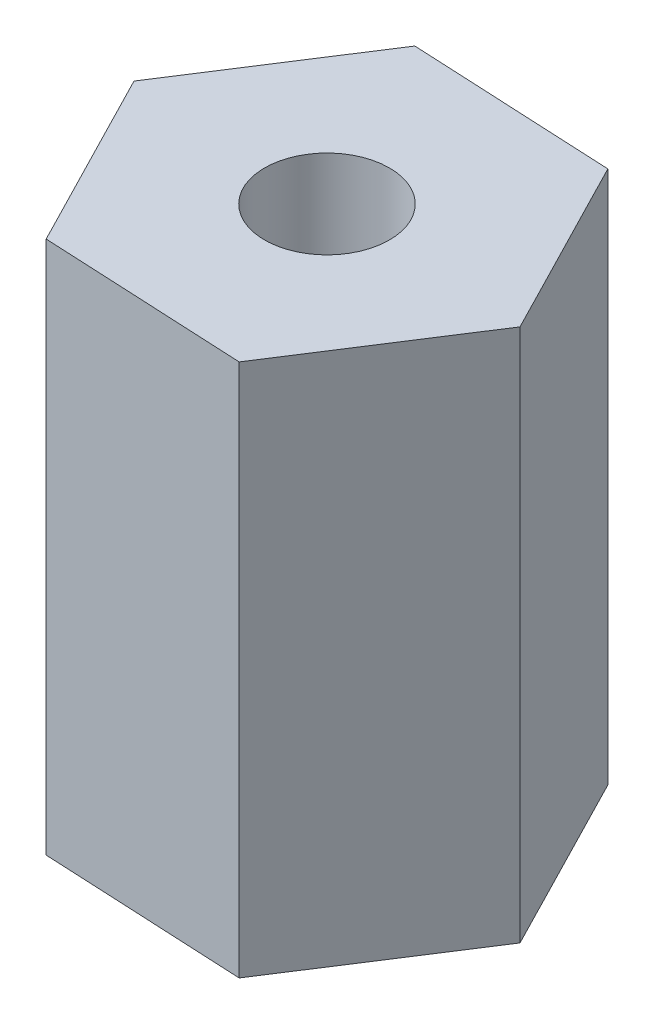
from build123d import *

# Parameters (mm, degrees)
BOSS_EXTRUDE1_DEPTH = 9.4
SKETCH2_R           = 1.1
CUT_EXTRUDE1_DEPTH  = 11.548866651


with BuildPart() as part:
    # Sketch1 → Boss-Extrude1 (new body)
    with BuildSketch(Plane(origin=(0, 0, 0), x_dir=(1, 0, 0), z_dir=(0, 1, 0))):
        Polygon((-1.636320259, 3.183675446), (-3.575303943, 0.17474281), (-1.938983684, -3.008932636), (1.636320259, -3.183675446), (3.575303943, -0.17474281), (1.938983684, 3.008932636), align=None)
    extrude(amount=BOSS_EXTRUDE1_DEPTH)

    # Sketch2 → Cut-Extrude1 (cut, through all)
    with BuildSketch(Plane.XZ):
        with Locations(Location((0, 0, 0), (0, 0, 270))):
            Circle(SKETCH2_R)
    extrude(amount=-CUT_EXTRUDE1_DEPTH, mode=Mode.SUBTRACT)


solid = part.part
